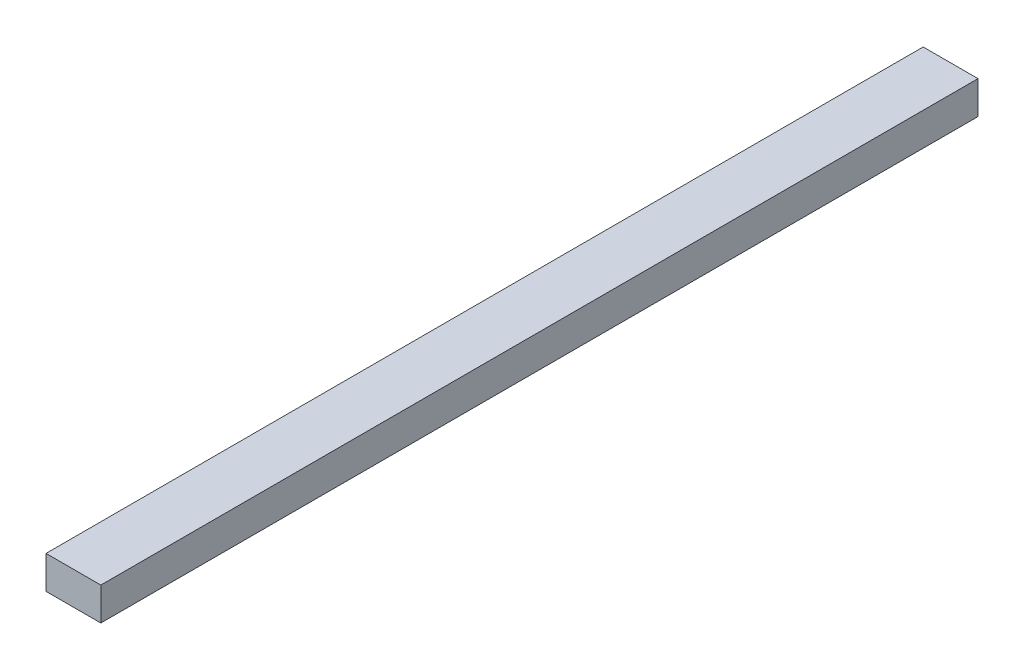
from build123d import *

# Parameters (mm, degrees)
SKETCH_1_W      = 50
SKETCH_1_H      = 30
EXTRUDE_1_DEPTH = 400


with BuildPart() as part:
    # Эскиз1 → Бобышка-Вытянуть1 (new, symmetric)
    with BuildSketch(Plane.XY):
        Rectangle(SKETCH_1_W, SKETCH_1_H)
    extrude(amount=EXTRUDE_1_DEPTH, both=True)


solid = part.part
